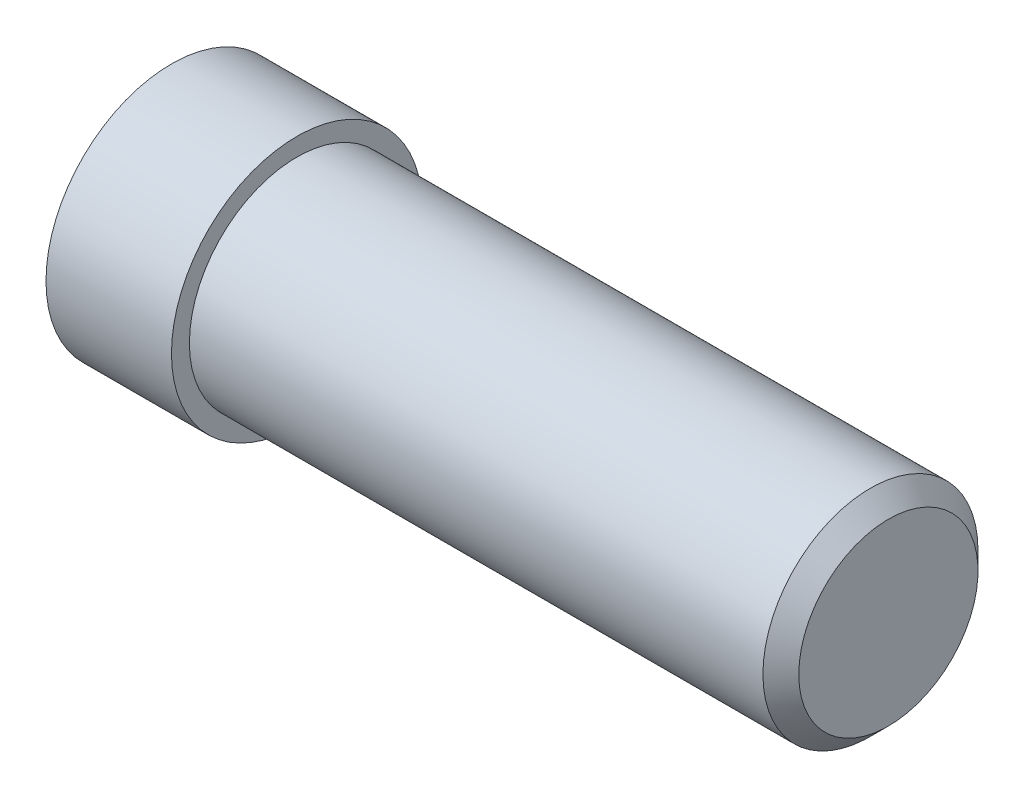
from build123d import *

# Parameters (mm, degrees)
CHAMFER1_SIZE = 1
SCALE1_SCALE  = 0.828947368


with BuildPart() as part:
    # Sketch1 → Revolve1 (revolve)
    with BuildSketch(Plane.XY, mode=Mode.PRIVATE) as revolve1_sk:
        Polygon((-41.050847458, 26.110169492), (-8.050847458, 26.110169492), (-8.050847458, 20.110169492), (-41.050847458, 20.110169492), (-48.050847458, 20.110169492), (-48.050847458, 27.110169492), (-41.050847458, 27.110169492), align=None)
    revolve(revolve1_sk.sketch.rotate(Axis((-48.881355932, 20.110169492, 0), (1, 0, 0)), 90), axis=Axis((-48.881355932, 20.110169492, 0), (1, 0, 0)))

    # Chamfer1
    chamfer1_edges = [part.edges().sort_by_distance(p)[0] for p in [
        (-8.050847458, 20.110169492, -6),
    ]]
    chamfer(chamfer1_edges, length=CHAMFER1_SIZE)


with BuildPart() as part_1:
    # Scale1: scaled about (-29.108266601, 20.110169492, 0)
    add(part.part.scale(SCALE1_SCALE).moved(Location((-4.979045615, 3.439897422, 0))))


solid = part_1.part
